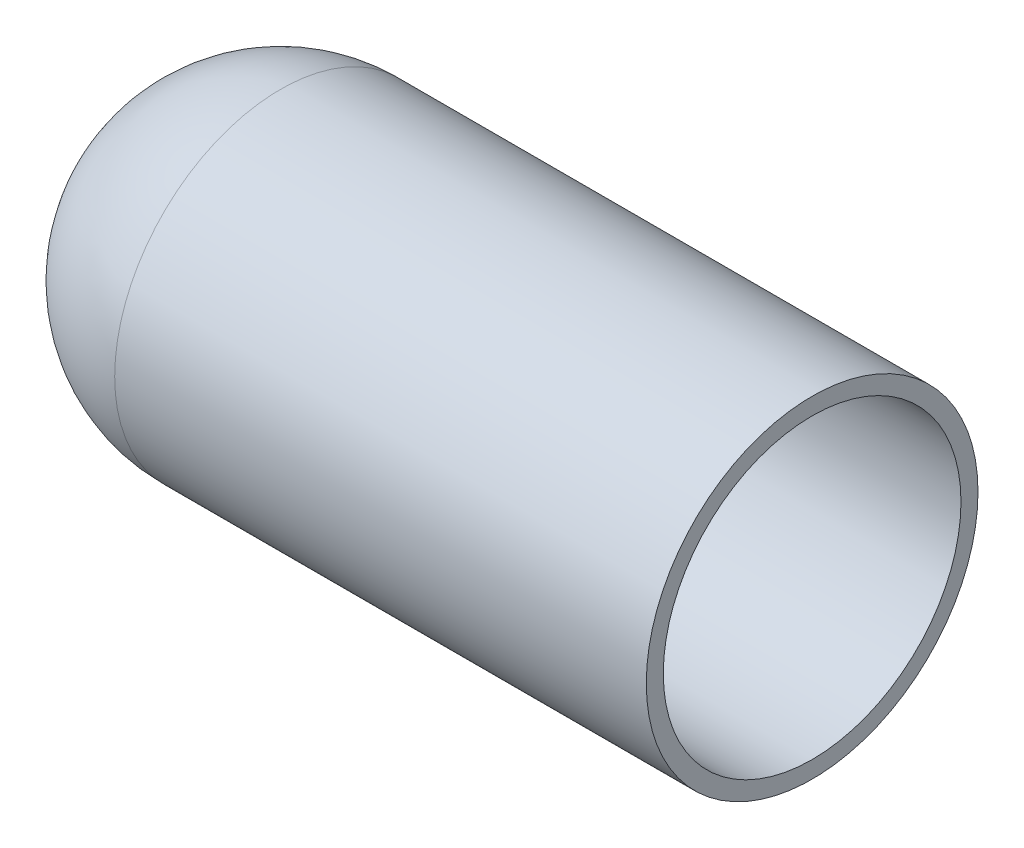
from build123d import *

# Parameters (mm, degrees)
SHELL1_T = -1


with BuildPart() as part:
    # Sketch1 → Revolve1 (revolve)
    with BuildSketch(Plane(origin=(0, 0, 0), x_dir=(1, 0, 0), z_dir=(0, 1, 0)), mode=Mode.PRIVATE) as revolve1_sk:
        with BuildLine():
            Line((-16.159952826, 9.75), (15.090047174, 9.75))
            Line((15.090047174, 9.75), (15.090047174, 0))
            Line((15.090047174, 0), (-25.909952826, 0))
            ThreePointArc((-25.909952826, 0), (-23.054243943, 6.894291117), (-16.159952826, 9.75))
        make_face()
    revolve(revolve1_sk.sketch.rotate(Axis((-16.159952826, 0, 0), (1, 0, 0)), 180), axis=Axis((-16.159952826, 0, 0), (1, 0, 0)))

    # Shell1
    shell1_openings = [part.faces().sort_by_distance(p)[0] for p in [
        (15.090047174, 0, 0),
    ]]
    offset(amount=SHELL1_T, openings=shell1_openings, kind=Kind.INTERSECTION)


solid = part.part
